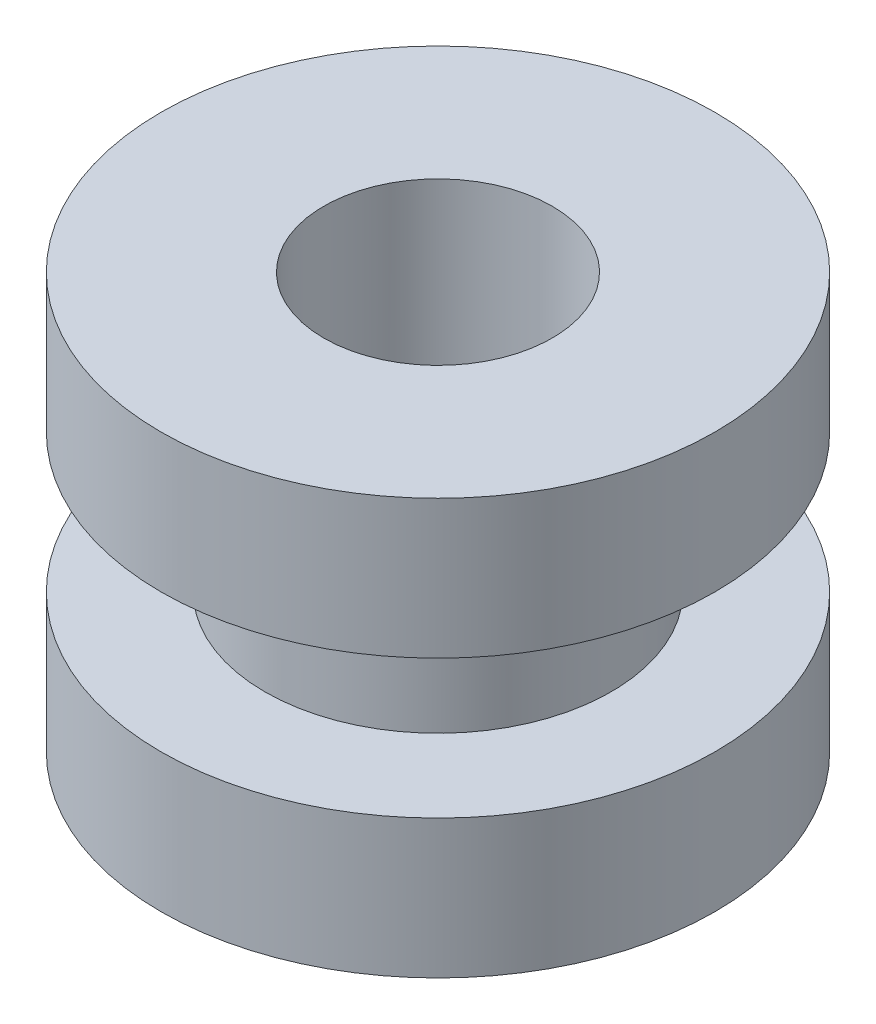
from build123d import *

# Parameters (mm, degrees)
CSK_FOR_M6_FLAT_HEAD_MACHINE_SCREW1_D           = 6.6
CSK_FOR_M6_FLAT_HEAD_MACHINE_SCREW1_CSINK_D     = 12.6
CSK_FOR_M6_FLAT_HEAD_MACHINE_SCREW1_CSINK_ANGLE = 90


with BuildPart() as part:
    # Sketch1 → Revolve1 (revolve)
    with BuildSketch(Plane.XY, mode=Mode.PRIVATE) as revolve1_sk:
        Polygon((0, 0), (0, -6), (-8, -6), (-8, -2), (-5, -2), (-5, 0), align=None)
    revolve(revolve1_sk.sketch.rotate(Axis((0, 0, 0), (0, -1, 0)), 270), axis=Axis((0, 0, 0), (0, -1, 0)))

    # Mirror1: part across plane


with BuildPart() as part_1:
    add(part.part)
    add(part.part.mirror(Plane(origin=(-5, 0, 0), x_dir=(0, 0, 1), z_dir=(0, 1, 0))))

    # CSK for M6 Flat Head Machine Screw1 (through all)
    with Locations(Plane(origin=(0, -6, 0), x_dir=(-1, 0, 0), z_dir=(0, -1, 0))):
        with Locations((0, 0)):
            CounterSinkHole(CSK_FOR_M6_FLAT_HEAD_MACHINE_SCREW1_D / 2, CSK_FOR_M6_FLAT_HEAD_MACHINE_SCREW1_CSINK_D / 2, counter_sink_angle=CSK_FOR_M6_FLAT_HEAD_MACHINE_SCREW1_CSINK_ANGLE)


solid = part_1.part
